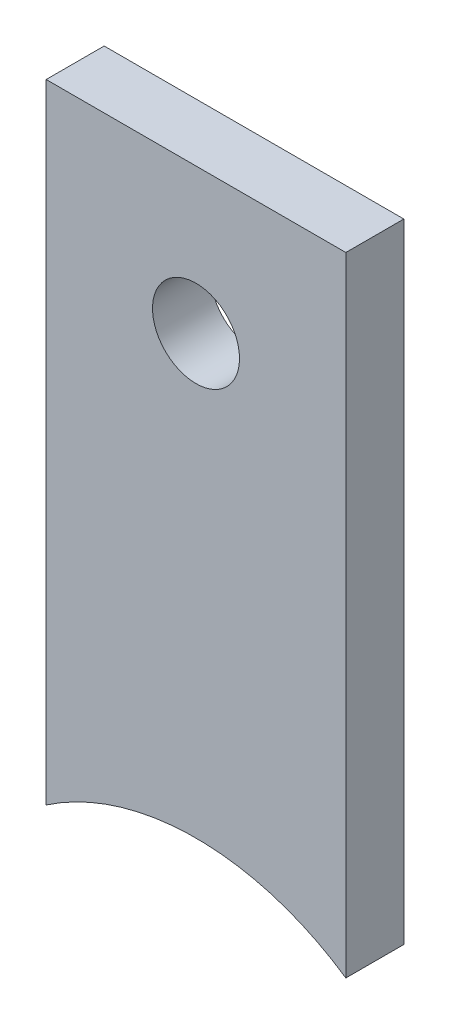
from build123d import *

# Parameters (mm, degrees)
BOSS_EXTRUDE1_DEPTH = 12
SKETCH2_R           = 9
CUT_EXTRUDE1_DEPTH  = 12


with BuildPart() as part:
    # Sketch1 → Boss-Extrude1 (new body)
    with BuildSketch(Plane.XY):
        with BuildLine():
            Line((0, 146.132978723), (-62, 146.132978723))
            Line((-62, 146.132978723), (-62, 16.132978723))
            ThreePointArc((-62, 16.132978723), (-31, 25.701711957), (0, 16.132978723))
            Line((0, 16.132978723), (0, 146.132978723))
        make_face()
    extrude(amount=BOSS_EXTRUDE1_DEPTH)

    # Sketch2 → Cut-Extrude1 (cut)
    with BuildSketch(Plane.XY.offset(12)):
        with Locations((-31, 116.132978723)):
            Circle(SKETCH2_R)
    extrude(amount=-CUT_EXTRUDE1_DEPTH, mode=Mode.SUBTRACT)


solid = part.part
